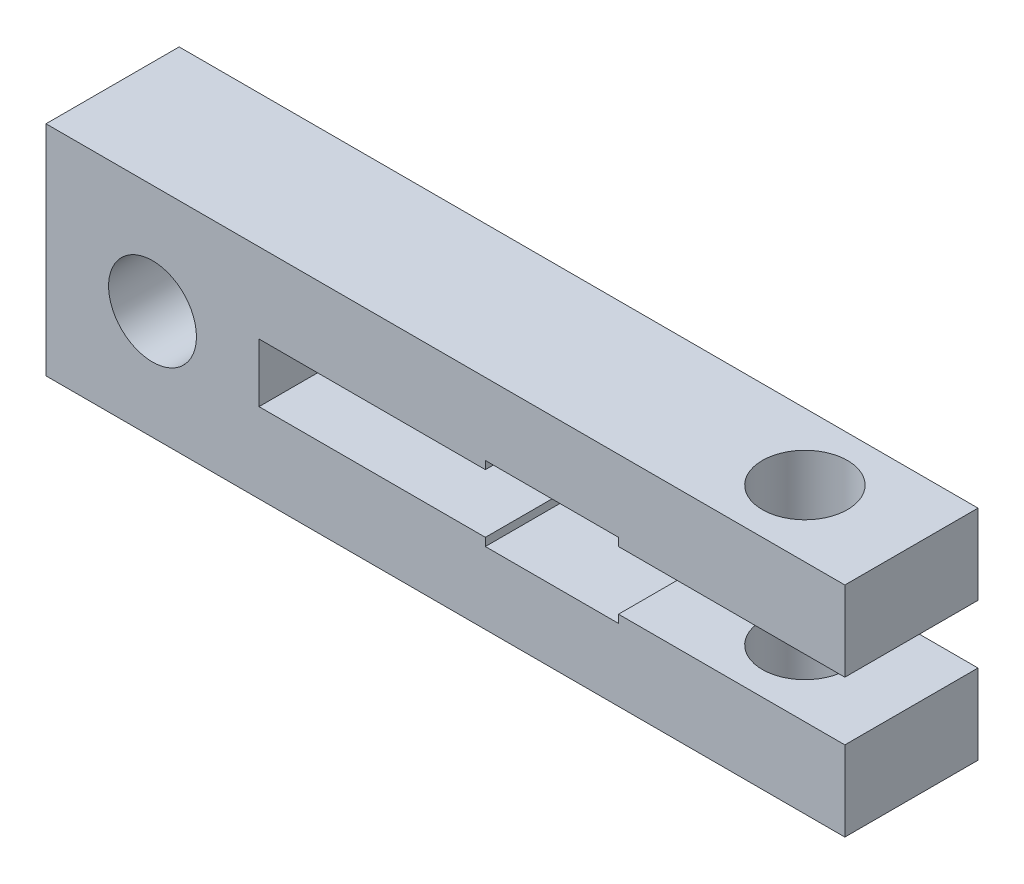
from build123d import *

# Parameters (mm, degrees)
SKETCH_1_W          = 30
SKETCH_1_H          = 3
SKETCH_1_W_2        = 8
SKETCH_1_H_2        = 2.2
EXTRUDE_2_DEPTH     = 2.5
SKETCH_2_R          = 1.65
CUT_EXTRUDE_1_DEPTH = 14
SKETCH_3_W          = 5
SKETCH_3_H          = 2.8
CUT_EXTRUDE_2_DEPTH = 14
SKETCH_5_R          = 1.6
CUT_EXTRUDE_3_DEPTH = 50


with BuildPart() as part:
    # 草图1 → 凸台-拉伸2 (new, symmetric)
    with BuildSketch(Plane.XY):
        with Locations((0, 2.6)):
            Rectangle(SKETCH_1_W, SKETCH_1_H)
        with Locations((-11, 0)):
            Rectangle(SKETCH_1_W_2, SKETCH_1_H_2)
        with Locations((0, -2.6)):
            Rectangle(SKETCH_1_W, SKETCH_1_H)
    extrude(amount=EXTRUDE_2_DEPTH, both=True)

    # 草图2 → 切除-拉伸1 (cut)
    with BuildSketch(Plane.XY.offset(2.5)):
        with Locations((-11, 0)):
            Circle(SKETCH_2_R)
    extrude(amount=-CUT_EXTRUDE_1_DEPTH, mode=Mode.SUBTRACT)

    # 草图3 → 切除-拉伸2 (cut)
    with BuildSketch(Plane.XY.offset(2.5)):
        with Locations((4, 0)):
            Rectangle(SKETCH_3_W, SKETCH_3_H)
    extrude(amount=-CUT_EXTRUDE_2_DEPTH, mode=Mode.SUBTRACT)

    # 草图5 → 切除-拉伸3 (cut)
    with BuildSketch(Plane(origin=(0, 4.1, 0), x_dir=(1, 0, 0), z_dir=(0, 1, 0))):
        with Locations(Location((11, 0, 0), (0, 0, 180))):
            Circle(SKETCH_5_R)
    extrude(amount=-CUT_EXTRUDE_3_DEPTH, mode=Mode.SUBTRACT)


solid = part.part
